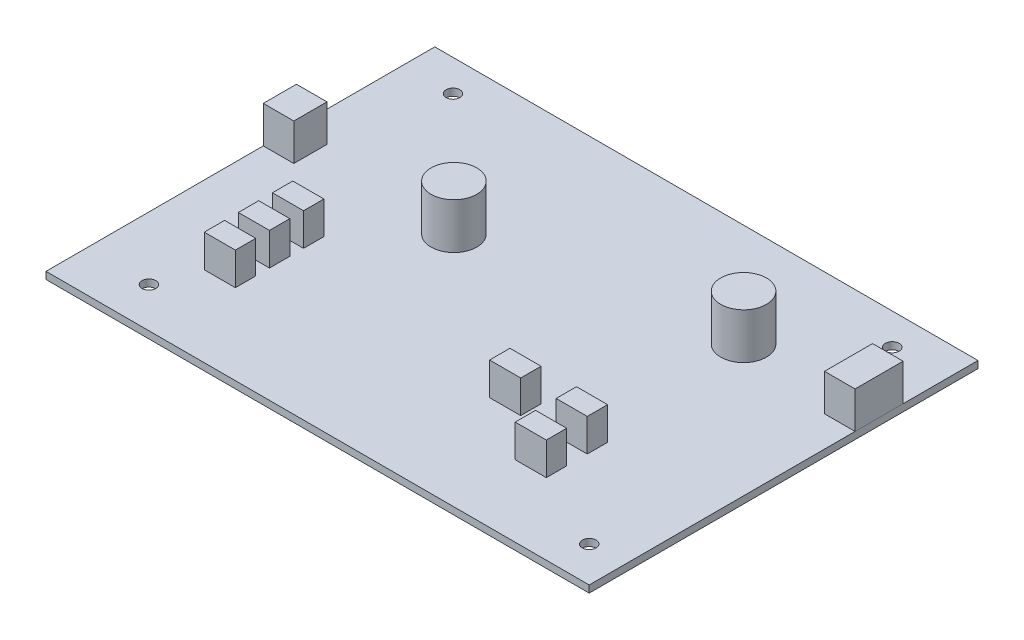
from build123d import *

# Parameters (mm, degrees)
SKETCH1_W          = 120.65
SKETCH1_H          = 86.36
PCB_DEPTH          = 1.5748
SKETCH2_R          = 5.08
CAPACITORS_DEPTH   = 10.16
SKETCH3_W          = 6.7818
SKETCH3_H          = 7.366
CONNECTORS_DEPTH   = 8.1788
SKETCH3_H_2        = 10.668
CONNECTORS_2_DEPTH = 8.1788
SKETCH4_W          = 6.9088
SKETCH4_H          = 4.5212
POTS_DEPTH         = 7.239
POTS_2_DEPTH       = 7.239
POTS_3_DEPTH       = 7.239
POTS_4_DEPTH       = 7.239
POTS_5_DEPTH       = 7.239
POTS_6_DEPTH       = 7.239
SKETCH5_R          = 1.524
CUT_EXTRUDE1_DEPTH = 75.878859667


with BuildPart() as part:
    # Sketch1 → PCB (new body)
    with BuildSketch(Plane(origin=(0, 0, 0), x_dir=(1, 0, 0), z_dir=(0, 1, 0))):
        Rectangle(SKETCH1_W, SKETCH1_H)
    extrude(amount=PCB_DEPTH)

    # Sketch2 → Capacitors (add)
    with BuildSketch(Plane(origin=(0, 1.5748, 0), x_dir=(1, 0, 0), z_dir=(0, 1, 0))):
        with Locations(Location((-22.225, 9.3218, 0), (0, 0, 270))):
            Circle(SKETCH2_R)
        with Locations(Location((31.115, 20.32, 0), (0, 0, 270))):
            Circle(SKETCH2_R)
    extrude(amount=CAPACITORS_DEPTH)

    # Sketch5 → Cut-Extrude1 (cut, through all)
    with BuildSketch(Plane(origin=(0, 1.5748, 0), x_dir=(1, 0, 0), z_dir=(0, 1, 0))):
        with Locations(Location((-49.3014, 36.195, 0), (0, 0, 270))):
            Circle(SKETCH5_R)
        with Locations(Location((48.26, 36.195, 0), (0, 0, 270))):
            Circle(SKETCH5_R)
        with Locations(Location((-46.355, -34.29, 0), (0, 0, 270))):
            Circle(SKETCH5_R)
        with Locations(Location((52.451, -35.306, 0), (0, 0, 270))):
            Circle(SKETCH5_R)
    extrude(amount=-CUT_EXTRUDE1_DEPTH, mode=Mode.SUBTRACT)


with BuildPart() as body_2:
    # Sketch3 → Connectors (new body)
    with BuildSketch(Plane(origin=(0, 1.5748, 0), x_dir=(1, 0, 0), z_dir=(0, 1, 0))):
        with Locations((-56.9341, 8.763)):
            Rectangle(SKETCH3_W, SKETCH3_H)
    extrude(amount=CONNECTORS_DEPTH)


with BuildPart() as body_3:
    # Sketch3 → Connectors 2 (new body)
    with BuildSketch(Plane(origin=(0, 1.5748, 0), x_dir=(1, 0, 0), z_dir=(0, 1, 0))):
        with Locations((56.9341, 21.209)):
            Rectangle(SKETCH3_W, SKETCH3_H_2)
    extrude(amount=CONNECTORS_2_DEPTH)


with BuildPart() as body_4:
    # Sketch4 → Pots (new body)
    with BuildSketch(Plane(origin=(0, 1.5748, 0), x_dir=(1, 0, 0), z_dir=(0, 1, 0))):
        with Locations((-39.5986, -7.8994)):
            Rectangle(SKETCH4_W, SKETCH4_H)
    extrude(amount=POTS_DEPTH)


with BuildPart() as body_5:
    # Sketch4 → Pots 2 (new body)
    with BuildSketch(Plane(origin=(0, 1.5748, 0), x_dir=(1, 0, 0), z_dir=(0, 1, 0))):
        with Locations((-39.5986, -15.4686)):
            Rectangle(SKETCH4_W, SKETCH4_H)
    extrude(amount=POTS_2_DEPTH)


with BuildPart() as body_6:
    # Sketch4 → Pots 3 (new body)
    with BuildSketch(Plane(origin=(0, 1.5748, 0), x_dir=(1, 0, 0), z_dir=(0, 1, 0))):
        with Locations((-39.5986, -23.0378)):
            Rectangle(SKETCH4_W, SKETCH4_H)
    extrude(amount=POTS_3_DEPTH)


with BuildPart() as body_7:
    # Sketch4 → Pots 4 (new body)
    with BuildSketch(Plane(origin=(0, 1.5748, 0), x_dir=(1, 0, 0), z_dir=(0, 1, 0))):
        with Locations((31.4706, -15.9512)):
            Rectangle(SKETCH4_W, SKETCH4_H)
    extrude(amount=POTS_4_DEPTH)


with BuildPart() as body_8:
    # Sketch4 → Pots 5 (new body)
    with BuildSketch(Plane(origin=(0, 1.5748, 0), x_dir=(1, 0, 0), z_dir=(0, 1, 0))):
        with Locations((31.4706, -25.0444)):
            Rectangle(SKETCH4_W, SKETCH4_H)
    extrude(amount=POTS_5_DEPTH)


with BuildPart() as body_9:
    # Sketch4 → Pots 6 (new body)
    with BuildSketch(Plane(origin=(0, 1.5748, 0), x_dir=(1, 0, 0), z_dir=(0, 1, 0))):
        with Locations((16.6878, -15.9512)):
            Rectangle(SKETCH4_W, SKETCH4_H)
    extrude(amount=POTS_6_DEPTH)


solid = Compound([part.part, body_2.part, body_3.part, body_4.part, body_5.part, body_6.part, body_7.part, body_8.part, body_9.part])
